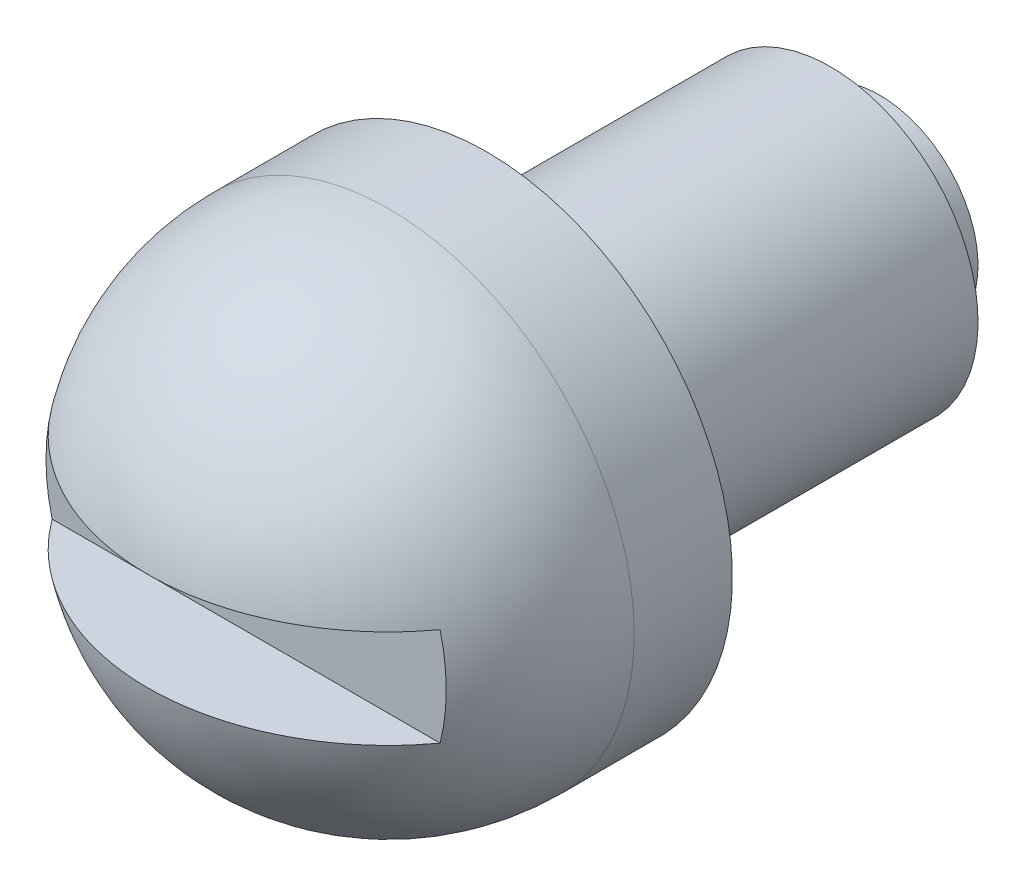
from build123d import *

# Parameters (mm, degrees)
CUT_EXTRUDE1_DEPTH      = 15.558488421
CUT_EXTRUDE1_DEPTH_BACK = 15.558488421
SKETCH2_W               = 4.202041029
SKETCH2_H               = 2


with BuildPart() as part:
    # Sketch1 → Revolve1 (revolve)
    with BuildSketch(Plane(origin=(0, 0, 0), x_dir=(0, 0, -1), z_dir=(1, 0, 0)), mode=Mode.PRIVATE) as revolve1_sk:
        with BuildLine():
            Line((2.274058577, 0), (2.274058577, 2))
            Line((2.274058577, 2), (1.274058577, 2))
            Line((1.274058577, 2), (1.274058577, 3))
            Line((1.274058577, 3), (-5.725941423, 3))
            Line((-5.725941423, 3), (-5.725941423, 5))
            Line((-5.725941423, 5), (-7.725941423, 5))
            ThreePointArc((-7.725941423, 5), (-11.261475329, 3.535533906), (-12.725941423, 0))
            Line((-12.725941423, 0), (2.274058577, 0))
        make_face()
    revolve(revolve1_sk.sketch.rotate(Axis((0, 0, 24), (0, 0, -1)), 180), axis=Axis((0, 0, 24), (0, 0, -1)))

    # Sketch2 → Cut-Extrude1 (cut, two sides: drawn at the far end of the back side and taken through both)
    with BuildSketch(Plane(origin=(0, 0, 0), x_dir=(0, 0, -1), z_dir=(1, 0, 0)).offset(-CUT_EXTRUDE1_DEPTH_BACK)):
        with Locations((-12.725941423, 0)):
            Rectangle(SKETCH2_W, SKETCH2_H)
    extrude(amount=CUT_EXTRUDE1_DEPTH + CUT_EXTRUDE1_DEPTH_BACK, mode=Mode.SUBTRACT)


solid = part.part
